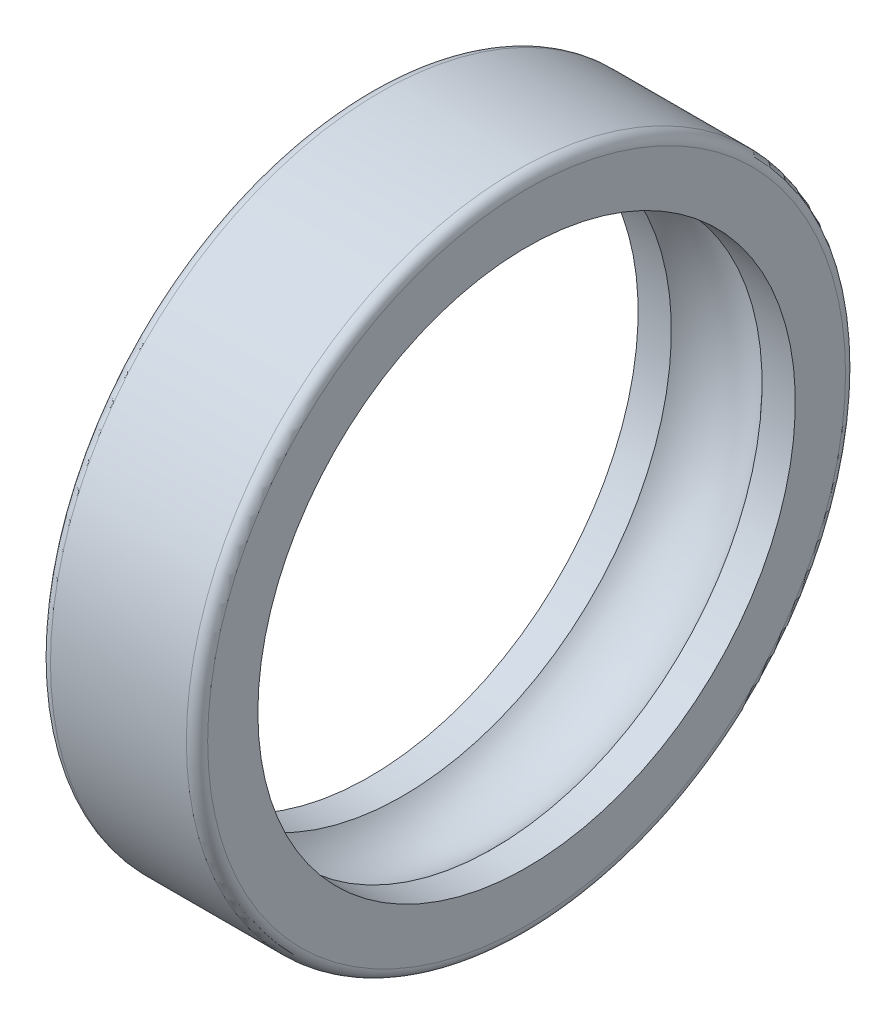
from build123d import *

# Parameters (mm, degrees)
FILLET1_R = 2.1


with BuildPart() as part:
    # Sketch2 → Revolve1 (revolve)
    with BuildSketch(Plane.XY, mode=Mode.PRIVATE) as revolve1_sk:
        with BuildLine():
            Line((15.5, 65), (-15.5, 65))
            Line((-15.5, 65), (-15.5, 53))
            Line((-15.5, 53), (-8.94427191, 53))
            ThreePointArc((-8.94427191, 53), (0, 57), (8.94427191, 53))
            Line((8.94427191, 53), (15.5, 53))
            Line((15.5, 53), (15.5, 65))
        make_face()
    revolve(revolve1_sk.sketch.rotate(Axis((-15.5, 0, 0), (1, 0, 0)), 90), axis=Axis((-15.5, 0, 0), (1, 0, 0)))

    # Fillet1
    fillet1_edges = [part.edges().sort_by_distance(p)[0] for p in [
        (15.5, 0, -65),
        (-15.5, 0, -65),
    ]]
    fillet(fillet1_edges, radius=FILLET1_R)


solid = part.part
